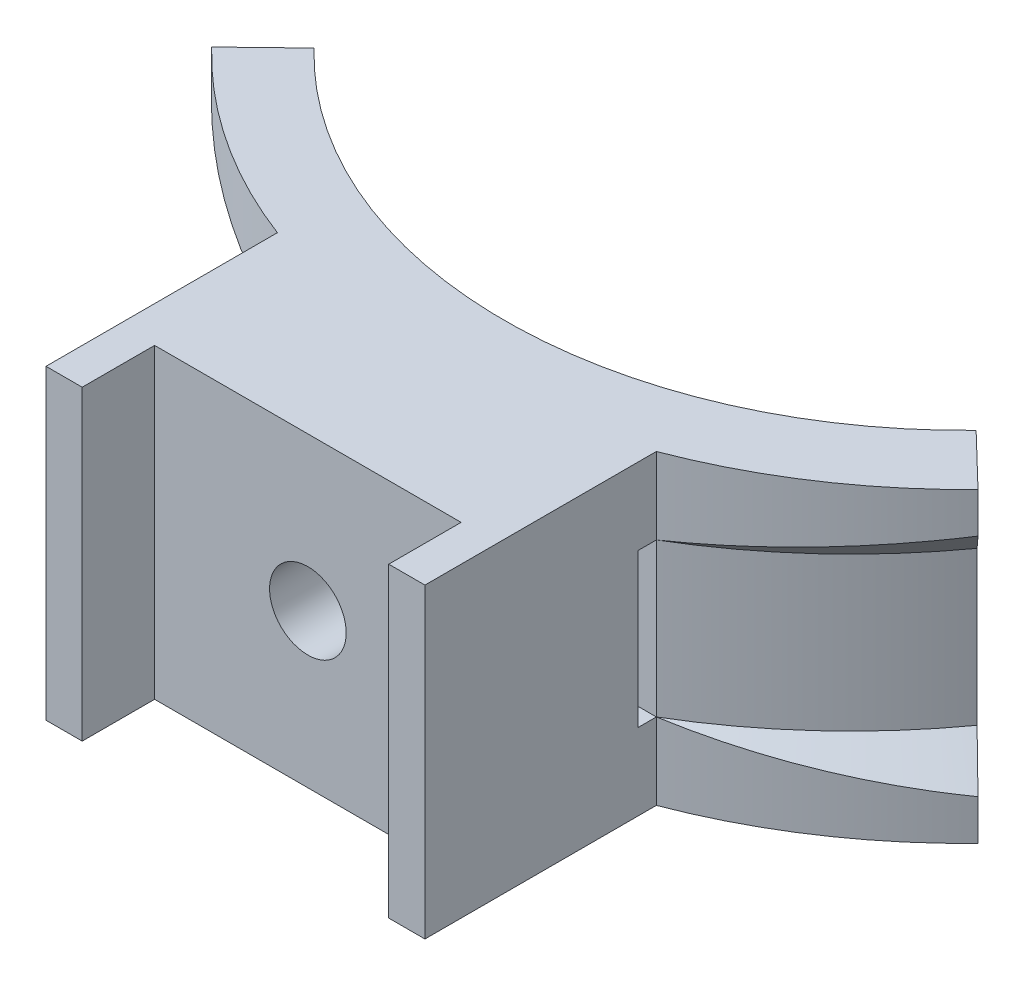
from build123d import *

# Parameters (mm, degrees)
BOSS_EXTRUDE1_DEPTH     = 25.4
SKETCH2_W               = 1.5
SKETCH2_H               = 12.7
CUT_EXTRUDE1_DEPTH      = 81.888878871
CUT_EXTRUDE2_DEPTH      = 12.7
SKETCH6_R               = 3.175
CUT_EXTRUDE4_DEPTH      = 50.335811816
CUT_EXTRUDE5_DEPTH      = 4.365625
CUT_EXTRUDE5_DEPTH_BACK = 47.366407345


with BuildPart() as part:
    # Sketch1 → Boss-Extrude1 (new body)
    with BuildSketch(Plane(origin=(0, 0, 0), x_dir=(1, 0, 0), z_dir=(0, 1, 0))):
        with BuildLine():
            Line((-12.7, -54.385), (12.7, -54.385))
            Line((12.7, -54.385), (12.7, -60.385))
            Line((12.7, -60.385), (15.7, -60.385))
            Line((15.7, -60.385), (15.7, -41.210678228))
            ThreePointArc((15.7, -41.210678228), (24.31025853, -36.794311112), (31.75, -30.606331044))
            Line((31.75, -30.606331044), (27.430272109, -26.442204372))
            ThreePointArc((27.430272109, -26.442204372), (0, -38.1), (-27.430272109, -26.442204372))
            Line((-27.430272109, -26.442204372), (-31.75, -30.606331044))
            ThreePointArc((-31.75, -30.606331044), (-24.31025853, -36.794311112), (-15.7, -41.210678228))
            Line((-15.7, -41.210678228), (-15.7, -60.385))
            Line((-15.7, -60.385), (-12.7, -60.385))
            Line((-12.7, -60.385), (-12.7, -54.385))
        make_face()
    extrude(amount=BOSS_EXTRUDE1_DEPTH)

    # Sketch2 → Cut-Extrude1 (cut, through all)
    with BuildSketch(Plane(origin=(15.7, 0, 0), x_dir=(0, 0, -1), z_dir=(1, 0, 0))):
        with Locations((-41.960678228, 12.7)):
            Rectangle(SKETCH2_W, SKETCH2_H)
    extrude(amount=-CUT_EXTRUDE1_DEPTH, mode=Mode.SUBTRACT)

    # Sketch3 → Cut-Extrude2 (cut)
    with BuildSketch(Plane(origin=(0, 6.35, 0), x_dir=(1, 0, 0), z_dir=(0, 1, 0))):
        with BuildLine():
            Line((31.75, -30.606331044), (29.590136054, -28.524267708))
            ThreePointArc((29.590136054, -28.524267708), (23.300825781, -35.585451028), (15.7, -41.210678228))
            ThreePointArc((15.7, -41.210678228), (24.31025853, -36.794311112), (31.75, -30.606331044))
        make_face()
    cut_extrude2 = extrude(amount=CUT_EXTRUDE2_DEPTH, mode=Mode.SUBTRACT)

    # Mirror1: Cut-Extrude2 across plane
    add(cut_extrude2.mirror(Plane(origin=(0, 0, 0), x_dir=(0, 0, 1), z_dir=(1, 0, 0))), mode=Mode.SUBTRACT)

    # Sketch6 → Cut-Extrude4 (cut, through all)
    with BuildSketch(Plane.XY.offset(54.385)):
        with Locations((0, 12.7)):
            Circle(SKETCH6_R)
    extrude(amount=-CUT_EXTRUDE4_DEPTH, mode=Mode.SUBTRACT)

    # Sketch7 → Cut-Extrude5 (cut, two sides: drawn at the far end of the back side and taken through both)
    with BuildSketch(Plane.XY.offset(38.1).offset(-CUT_EXTRUDE5_DEPTH_BACK)):
        Polygon((6.415804866, 12.7), (3.207902433, 18.25625), (-3.207902433, 18.25625), (-6.415804866, 12.7), (-3.207902433, 7.14375), (3.207902433, 7.14375), align=None)
    extrude(amount=CUT_EXTRUDE5_DEPTH + CUT_EXTRUDE5_DEPTH_BACK, mode=Mode.SUBTRACT)

    # Cut-Sweep1: sweep along a path in Sketch9
    with BuildLine(Plane.XZ.offset(-19.05)) as cut_sweep1_path:
        ThreePointArc((29.590136054, 28.524267708), (23.300825781, 35.585451028), (15.7, 41.210678228))
    # Sketch8 → Cut-Sweep1 (sweep, cut)
    with BuildSketch(Plane(origin=(0, 0, 0), x_dir=(-0.7199546485260769, 0, -0.6940211121181352), z_dir=(0.6940211121181352, 0, -0.7199546485260769))):
        Polygon((-44.1, 19.05), (-41.1, 19.05), (-44.1, 22.05), align=None)
    cut_sweep1 = sweep(path=cut_sweep1_path.line, mode=Mode.SUBTRACT)

    # Mirror2: Cut-Sweep1 across plane
    add(cut_sweep1.mirror(Plane.ZX.offset(12.7)), mode=Mode.SUBTRACT)

    # Mirror3: Cut-Sweep1 across plane
    add(cut_sweep1.mirror(Plane(origin=(0, 0, 0), x_dir=(0, 0, 1), z_dir=(1, 0, 0))), mode=Mode.SUBTRACT)

    # Mirror3 copy 1: sweep along a path in Mirror3 copy 1 path
    with BuildLine(Plane(origin=(0, 6.35, 0), x_dir=(-1, 0, 0), z_dir=(0, 1, 0))) as mirror3_copy_1_path:
        ThreePointArc((29.590136054, 28.524267708), (23.300825781, 35.585451028), (15.7, 41.210678228))
    # Mirror3 copy 1 sketch → Mirror3 copy 1 (sweep, cut)
    with BuildSketch(Plane(origin=(0, 25.4, 0), x_dir=(0.7199546485260769, 0, -0.6940211121181352), z_dir=(-0.6940211121181352, 0, -0.7199546485260769))):
        Polygon((-44.1, 19.05), (-41.1, 19.05), (-44.1, 22.05), align=None)
    sweep(path=mirror3_copy_1_path.line, mode=Mode.SUBTRACT)


solid = part.part
